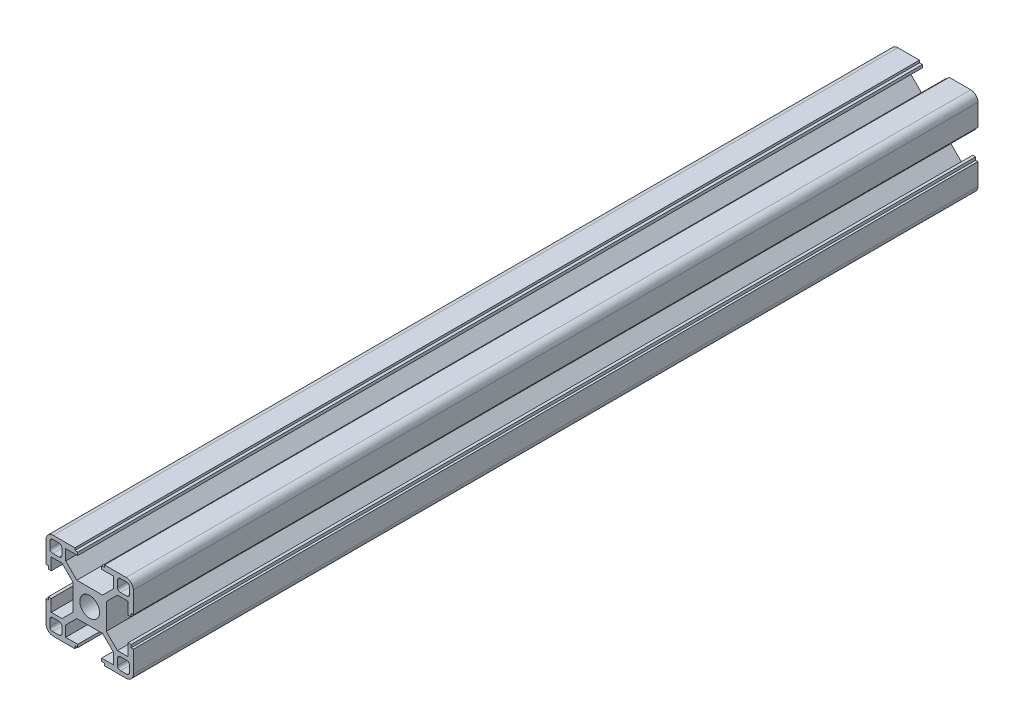
from build123d import *

# Parameters (mm, degrees)
SKETCH1_R      = 3.4
EXTRUDE1_DEPTH = 290
EXTRUDE2_DEPTH = 291.774826971


with BuildPart() as part:
    # Sketch1 → Extrude1 (new body)
    with BuildSketch(Plane.XY):
        with BuildLine():
            Line((-5.1, 14.2), (-5.1, 15))
            Line((-5.1, 15), (-12.5, 15))
            ThreePointArc((-12.5, 15), (-14.267766953, 14.267766953), (-15, 12.5))
            Line((-15, 12.5), (-15, 5.1))
            Line((-15, 5.1), (-14.2, 5.1))
            Line((-14.2, 5.1), (-14.2, 4.1))
            Line((-14.2, 4.1), (-13.2, 4.1))
            Line((-13.2, 4.1), (-13.2, 8.25))
            Line((-13.2, 8.25), (-9.522792206, 8.25))
            Line((-9.522792206, 8.25), (-5.7, 4.427207794))
            Line((-5.7, 4.427207794), (-5.7, -4.427207794))
            Line((-5.7, -4.427207794), (-9.522792206, -8.25))
            Line((-9.522792206, -8.25), (-13.2, -8.25))
            Line((-13.2, -8.25), (-13.2, -4.1))
            Line((-13.2, -4.1), (-14.2, -4.1))
            Line((-14.2, -4.1), (-14.2, -5.1))
            Line((-14.2, -5.1), (-15, -5.1))
            Line((-15, -5.1), (-15, -12.5))
            ThreePointArc((-15, -12.5), (-14.267766953, -14.267766953), (-12.5, -15))
            Line((-12.5, -15), (-5.1, -15))
            Line((-5.1, -15), (-5.1, -14.2))
            Line((-5.1, -14.2), (-4.1, -14.2))
            Line((-4.1, -14.2), (-4.1, -13.2))
            Line((-4.1, -13.2), (-8.25, -13.2))
            Line((-8.25, -13.2), (-8.25, -9.522792206))
            Line((-8.25, -9.522792206), (-4.427207794, -5.7))
            Line((-4.427207794, -5.7), (4.427207794, -5.7))
            Line((4.427207794, -5.7), (8.25, -9.522792206))
            Line((8.25, -9.522792206), (8.25, -13.2))
            Line((8.25, -13.2), (4.1, -13.2))
            Line((4.1, -13.2), (4.1, -14.2))
            Line((4.1, -14.2), (5.1, -14.2))
            Line((5.1, -14.2), (5.1, -15))
            Line((5.1, -15), (12.5, -15))
            ThreePointArc((12.5, -15), (14.267766953, -14.267766953), (15, -12.5))
            Line((15, -12.5), (15, -5.1))
            Line((15, -5.1), (14.2, -5.1))
            Line((14.2, -5.1), (14.2, -4.1))
            Line((14.2, -4.1), (13.2, -4.1))
            Line((13.2, -4.1), (13.2, -8.25))
            Line((13.2, -8.25), (9.522792206, -8.25))
            Line((9.522792206, -8.25), (5.7, -4.427207794))
            Line((5.7, -4.427207794), (5.7, 4.427207794))
            Line((5.7, 4.427207794), (9.522792206, 8.25))
            Line((9.522792206, 8.25), (13.2, 8.25))
            Line((13.2, 8.25), (13.2, 4.1))
            Line((13.2, 4.1), (14.2, 4.1))
            Line((14.2, 4.1), (14.2, 5.1))
            Line((14.2, 5.1), (15, 5.1))
            Line((15, 5.1), (15, 12.5))
            ThreePointArc((15, 12.5), (14.267766953, 14.267766953), (12.5, 15))
            Line((12.5, 15), (5.1, 15))
            Line((5.1, 15), (5.1, 14.2))
            Line((5.1, 14.2), (4.1, 14.2))
            Line((4.1, 14.2), (4.1, 13.2))
            Line((4.1, 13.2), (8.25, 13.2))
            Line((8.25, 13.2), (8.25, 9.522792206))
            Line((8.25, 9.522792206), (4.427207794, 5.7))
            Line((4.427207794, 5.7), (-4.427207794, 5.7))
            Line((-4.427207794, 5.7), (-8.25, 9.522792206))
            Line((-8.25, 9.522792206), (-8.25, 13.2))
            Line((-8.25, 13.2), (-4.1, 13.2))
            Line((-4.1, 13.2), (-4.1, 14.2))
            Line((-4.1, 14.2), (-5.1, 14.2))
        make_face()
        Circle(SKETCH1_R, mode=Mode.SUBTRACT)
    extrude(amount=EXTRUDE1_DEPTH)

    # Sketch2 → Extrude2 (cut, through all)
    with BuildSketch(Plane.XY.offset(290)):
        with BuildLine():
            Line((13.7, 12.7), (13.7, 10.55))
            ThreePointArc((13.7, 10.55), (13.407106781, 9.842893219), (12.7, 9.55))
            Line((12.7, 9.55), (10.55, 9.55))
            ThreePointArc((10.55, 9.55), (9.842893219, 9.842893219), (9.55, 10.55))
            Line((9.55, 10.55), (9.55, 12.7))
            ThreePointArc((9.55, 12.7), (9.842893219, 13.407106781), (10.55, 13.7))
            Line((10.55, 13.7), (12.7, 13.7))
            ThreePointArc((12.7, 13.7), (13.407106781, 13.407106781), (13.7, 12.7))
        make_face()
        with BuildLine():
            Line((-12.7, 13.7), (-10.55, 13.7))
            ThreePointArc((-10.55, 13.7), (-9.842893219, 13.407106781), (-9.55, 12.7))
            Line((-9.55, 12.7), (-9.55, 10.55))
            ThreePointArc((-9.55, 10.55), (-9.842893219, 9.842893219), (-10.55, 9.55))
            Line((-10.55, 9.55), (-12.7, 9.55))
            ThreePointArc((-12.7, 9.55), (-13.407106781, 9.842893219), (-13.7, 10.55))
            Line((-13.7, 10.55), (-13.7, 12.7))
            ThreePointArc((-13.7, 12.7), (-13.407106781, 13.407106781), (-12.7, 13.7))
        make_face()
        with BuildLine():
            Line((12.7, -13.7), (10.55, -13.7))
            ThreePointArc((10.55, -13.7), (9.842893219, -13.407106781), (9.55, -12.7))
            Line((9.55, -12.7), (9.55, -10.55))
            ThreePointArc((9.55, -10.55), (9.842893219, -9.842893219), (10.55, -9.55))
            Line((10.55, -9.55), (12.7, -9.55))
            ThreePointArc((12.7, -9.55), (13.407106781, -9.842893219), (13.7, -10.55))
            Line((13.7, -10.55), (13.7, -12.7))
            ThreePointArc((13.7, -12.7), (13.407106781, -13.407106781), (12.7, -13.7))
        make_face()
        with BuildLine():
            Line((-13.7, -12.7), (-13.7, -10.55))
            ThreePointArc((-13.7, -10.55), (-13.407106781, -9.842893219), (-12.7, -9.55))
            Line((-12.7, -9.55), (-10.55, -9.55))
            ThreePointArc((-10.55, -9.55), (-9.842893219, -9.842893219), (-9.55, -10.55))
            Line((-9.55, -10.55), (-9.55, -12.7))
            ThreePointArc((-9.55, -12.7), (-9.842893219, -13.407106781), (-10.55, -13.7))
            Line((-10.55, -13.7), (-12.7, -13.7))
            ThreePointArc((-12.7, -13.7), (-13.407106781, -13.407106781), (-13.7, -12.7))
        make_face()
    extrude(amount=-EXTRUDE2_DEPTH, mode=Mode.SUBTRACT)


solid = part.part
